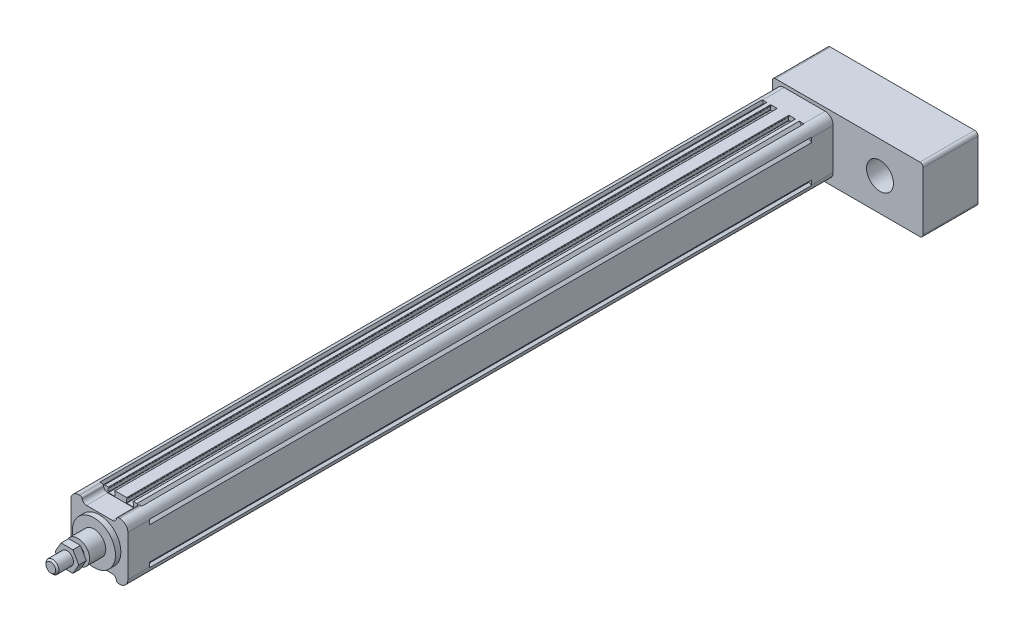
from build123d import *

# Parameters (mm, degrees)
SKETCH_1_R                  = 2.1
EXTRUDE_1_DEPTH             = 615
EXTRUDE_2_DEPTH             = 20
SKETCH_7_R                  = 20
EXTRUDE_3_DEPTH             = 5
SKETCH_9_R                  = 11
EXTRUDE_4_DEPTH             = 15
SKETCH_10_R                 = 6
EXTRUDE_5_DEPTH             = 25
EXTRUDE_START               = 20
EXTRUDE_6_DEPTH             = 20
EXTRUDE_7_DEPTH             = 51
SKETCH_13_R                 = 12.5
CUT_EXTRUDE_2_DEPTH         = 30
PATTERN_LINEAR_1_COUNT      = 2
PATTERN_LINEAR_1_PITCH      = 38
PATTERN_LINEAR_1_COUNT_DIR2 = 2
PATTERN_LINEAR_1_PITCH_DIR2 = 38
HOLE_WIZARD_M6_2_D          = 5
HOLE_WIZARD_M6_2_DEPTH      = 15
HOLE_WIZARD_M6_2_TIP        = 1.502151548
HOLE_WIZARD_M6_3_D          = 5
HOLE_WIZARD_M6_3_DEPTH      = 15
HOLE_WIZARD_M6_3_TIP        = 1.502151548
HOLE_WIZARD_M6_4_D          = 5
HOLE_WIZARD_M6_4_DEPTH      = 15
HOLE_WIZARD_M6_4_TIP        = 1.502151548
CHAMFER_1_SIZE              = 1.5
EXTRUDE_START_2             = 3
EXTRUDE_8_DEPTH             = 7


with BuildPart() as part:
    # 草图1 → 凸台-拉伸1 (new body)
    with BuildSketch(Plane.XY):
        with BuildLine():
            Line((-18.2, 24), (-19.443439638, 26.486879276))
            ThreePointArc((-19.443439638, 26.486879276), (-24.303300859, 24.303300859), (-26.486879276, 19.443439638))
            Line((-26.486879276, 19.443439638), (-24, 18.2))
            Line((-24, 18.2), (-24, 17.1))
            Line((-24, 17.1), (-26.5, 15))
            Line((-26.5, 15), (-26.5, -15))
            Line((-26.5, -15), (-24, -17.1))
            Line((-24, -17.1), (-24, -18.2))
            Line((-24, -18.2), (-26.486879276, -19.443439638))
            ThreePointArc((-26.486879276, -19.443439638), (-24.303300859, -24.303300859), (-19.443439638, -26.486879276))
            Line((-19.443439638, -26.486879276), (-18.2, -24))
            Line((-18.2, -24), (-17.1, -24))
            Line((-17.1, -24), (-15, -26.5))
            Line((-15, -26.5), (-11.65, -26.5))
            ThreePointArc((-11.65, -26.5), (-11.367157288, -26.382842712), (-11.25, -26.1))
            Line((-11.25, -26.1), (-11.25, -25.6))
            ThreePointArc((-11.25, -25.6), (-11.367157288, -25.317157288), (-11.65, -25.2))
            Line((-11.65, -25.2), (-11.75, -25.2))
            Line((-11.75, -25.2), (-11.75, -22.4))
            ThreePointArc((-11.75, -22.4), (-11.632842712, -22.117157288), (-11.35, -22))
            Line((-11.35, -22), (-5.65, -22))
            ThreePointArc((-5.65, -22), (-5.367157288, -22.117157288), (-5.25, -22.4))
            Line((-5.25, -22.4), (-5.25, -25.2))
            Line((-5.25, -25.2), (-5.35, -25.2))
            ThreePointArc((-5.35, -25.2), (-5.632842712, -25.317157288), (-5.75, -25.6))
            Line((-5.75, -25.6), (-5.75, -26.1))
            ThreePointArc((-5.75, -26.1), (-5.632842712, -26.382842712), (-5.35, -26.5))
            Line((-5.35, -26.5), (5.35, -26.5))
            ThreePointArc((5.35, -26.5), (5.632842712, -26.382842712), (5.75, -26.1))
            Line((5.75, -26.1), (5.75, -25.6))
            ThreePointArc((5.75, -25.6), (5.632842712, -25.317157288), (5.35, -25.2))
            Line((5.35, -25.2), (5.25, -25.2))
            Line((5.25, -25.2), (5.25, -22.4))
            ThreePointArc((5.25, -22.4), (5.367157288, -22.117157288), (5.65, -22))
            Line((5.65, -22), (11.35, -22))
            ThreePointArc((11.35, -22), (11.632842712, -22.117157288), (11.75, -22.4))
            Line((11.75, -22.4), (11.75, -25.2))
            Line((11.75, -25.2), (11.65, -25.2))
            ThreePointArc((11.65, -25.2), (11.367157288, -25.317157288), (11.25, -25.6))
            Line((11.25, -25.6), (11.25, -26.1))
            ThreePointArc((11.25, -26.1), (11.367157288, -26.382842712), (11.65, -26.5))
            Line((11.65, -26.5), (15, -26.5))
            Line((15, -26.5), (17.1, -24))
            Line((17.1, -24), (18.2, -24))
            Line((18.2, -24), (19.443439638, -26.486879276))
            ThreePointArc((19.443439638, -26.486879276), (24.303300859, -24.303300859), (26.486879276, -19.443439638))
            Line((26.486879276, -19.443439638), (24, -18.2))
            Line((24, -18.2), (24, -17.1))
            Line((24, -17.1), (26.5, -15))
            Line((26.5, -15), (26.5, 15))
            Line((26.5, 15), (24, 17.1))
            Line((24, 17.1), (24, 18.2))
            Line((24, 18.2), (26.486879276, 19.443439638))
            ThreePointArc((26.486879276, 19.443439638), (24.303300859, 24.303300859), (19.443439638, 26.486879276))
            Line((19.443439638, 26.486879276), (18.2, 24))
            Line((18.2, 24), (17.1, 24))
            Line((17.1, 24), (15, 26.5))
            Line((15, 26.5), (11.65, 26.5))
            ThreePointArc((11.65, 26.5), (11.367157288, 26.382842712), (11.25, 26.1))
            Line((11.25, 26.1), (11.25, 25.6))
            ThreePointArc((11.25, 25.6), (11.367157288, 25.317157288), (11.65, 25.2))
            Line((11.65, 25.2), (11.75, 25.2))
            Line((11.75, 25.2), (11.75, 22.4))
            ThreePointArc((11.75, 22.4), (11.632842712, 22.117157288), (11.35, 22))
            Line((11.35, 22), (5.65, 22))
            ThreePointArc((5.65, 22), (5.367157288, 22.117157288), (5.25, 22.4))
            Line((5.25, 22.4), (5.25, 25.2))
            Line((5.25, 25.2), (5.35, 25.2))
            ThreePointArc((5.35, 25.2), (5.632842712, 25.317157288), (5.75, 25.6))
            Line((5.75, 25.6), (5.75, 26.1))
            ThreePointArc((5.75, 26.1), (5.632842712, 26.382842712), (5.35, 26.5))
            Line((5.35, 26.5), (-5.35, 26.5))
            ThreePointArc((-5.35, 26.5), (-5.632842712, 26.382842712), (-5.75, 26.1))
            Line((-5.75, 26.1), (-5.75, 25.6))
            ThreePointArc((-5.75, 25.6), (-5.632842712, 25.317157288), (-5.35, 25.2))
            Line((-5.35, 25.2), (-5.25, 25.2))
            Line((-5.25, 25.2), (-5.25, 22.4))
            ThreePointArc((-5.25, 22.4), (-5.367157288, 22.117157288), (-5.65, 22))
            Line((-5.65, 22), (-11.35, 22))
            ThreePointArc((-11.35, 22), (-11.632842712, 22.117157288), (-11.75, 22.4))
            Line((-11.75, 22.4), (-11.75, 25.2))
            Line((-11.75, 25.2), (-11.65, 25.2))
            ThreePointArc((-11.65, 25.2), (-11.367157288, 25.317157288), (-11.25, 25.6))
            Line((-11.25, 25.6), (-11.25, 26.1))
            ThreePointArc((-11.25, 26.1), (-11.367157288, 26.382842712), (-11.65, 26.5))
            Line((-11.65, 26.5), (-15, 26.5))
            Line((-15, 26.5), (-17.1, 24))
            Line((-17.1, 24), (-18.2, 24))
        make_face()
        with Locations((19, 19)):
            Circle(SKETCH_1_R, mode=Mode.SUBTRACT)
        with Locations((19, -19)):
            Circle(SKETCH_1_R, mode=Mode.SUBTRACT)
        with Locations((-19, -19)):
            Circle(SKETCH_1_R, mode=Mode.SUBTRACT)
        with Locations((-19, 19)):
            Circle(SKETCH_1_R, mode=Mode.SUBTRACT)
        with BuildLine():
            Line((19.773719933, 3), (23.3, 3))
            Line((23.3, 3), (23.3, -3))
            Line((23.3, -3), (19.773719933, -3))
            ThreePointArc((19.773719933, -3), (0, -20), (-19.773719933, -3))
            Line((-19.773719933, -3), (-23.3, -3))
            Line((-23.3, -3), (-23.3, 3))
            Line((-23.3, 3), (-19.773719933, 3))
            ThreePointArc((-19.773719933, 3), (0, 20), (19.773719933, 3))
        make_face(mode=Mode.SUBTRACT)
    extrude(amount=EXTRUDE_1_DEPTH)

    # 草图6 → 凸台-拉伸2 (add)
    with BuildSketch(Plane.XY.offset(615)):
        with BuildLine():
            Line((-26.5, -19), (-26.5, 19))
            ThreePointArc((-26.5, 19), (-24.303300859, 24.303300859), (-19, 26.5))
            Line((-19, 26.5), (-17.916079783, 26.5))
            ThreePointArc((-17.916079783, 26.5), (-16.625085334, 26.027525232), (-15.944053189, 24.833333333))
            ThreePointArc((-15.944053189, 24.833333333), (-14.581988897, 22.444949537), (-12, 21.5))
            Line((-12, 21.5), (12, 21.5))
            ThreePointArc((12, 21.5), (14.581988897, 22.444949537), (15.944053189, 24.833333333))
            ThreePointArc((15.944053189, 24.833333333), (16.625085334, 26.027525232), (17.916079783, 26.5))
            Line((17.916079783, 26.5), (19, 26.5))
            ThreePointArc((19, 26.5), (24.303300859, 24.303300859), (26.5, 19))
            Line((26.5, 19), (26.5, -19))
            ThreePointArc((26.5, -19), (24.303300859, -24.303300859), (19, -26.5))
            Line((19, -26.5), (17.916079783, -26.5))
            ThreePointArc((17.916079783, -26.5), (16.625085334, -26.027525232), (15.944053189, -24.833333333))
            ThreePointArc((15.944053189, -24.833333333), (14.581988897, -22.444949537), (12, -21.5))
            Line((12, -21.5), (-12, -21.5))
            ThreePointArc((-12, -21.5), (-14.581988897, -22.444949537), (-15.944053189, -24.833333333))
            ThreePointArc((-15.944053189, -24.833333333), (-16.625085334, -26.027525232), (-17.916079783, -26.5))
            Line((-17.916079783, -26.5), (-19, -26.5))
            ThreePointArc((-19, -26.5), (-24.303300859, -24.303300859), (-26.5, -19))
        make_face()
    extrude(amount=EXTRUDE_2_DEPTH)

    # 草图7 → 凸台-拉伸3 (add)
    with BuildSketch(Plane.XY.offset(635)):
        Circle(SKETCH_7_R)
    extrude(amount=EXTRUDE_3_DEPTH)

    # 草图9 → 凸台-拉伸4 (add)
    with BuildSketch(Plane.XY.offset(640)):
        Circle(SKETCH_9_R)
    extrude(amount=EXTRUDE_4_DEPTH)

    # 草图10 → 凸台-拉伸5 (add)
    with BuildSketch(Plane.XY.offset(655)):
        Circle(SKETCH_10_R)
    extrude(amount=EXTRUDE_5_DEPTH)

    # 草图11 → 凸台-拉伸6 (add)
    with BuildSketch(Plane(origin=(0, 0, 0), x_dir=(-1, 0, 0), z_dir=(0, 0, -1)).offset(EXTRUDE_START)):
        with BuildLine():
            Line((-19, -26.5), (19, -26.5))
            ThreePointArc((19, -26.5), (24.303300859, -24.303300859), (26.5, -19))
            Line((26.5, -19), (26.5, 19))
            ThreePointArc((26.5, 19), (24.303300859, 24.303300859), (19, 26.5))
            Line((19, 26.5), (-19, 26.5))
            ThreePointArc((-19, 26.5), (-24.303300859, 24.303300859), (-26.5, 19))
            Line((-26.5, 19), (-26.5, -19))
            ThreePointArc((-26.5, -19), (-24.303300859, -24.303300859), (-19, -26.5))
        make_face()
    extrude(amount=-EXTRUDE_6_DEPTH)

    # 草图12 → 凸台-拉伸7 (add)
    with BuildSketch(Plane(origin=(0, 0, -20), x_dir=(-1, 0, 0), z_dir=(0, 0, -1))):
        with BuildLine():
            Line((-107, -30.404162038), (27, -30.404162038))
            ThreePointArc((27, -30.404162038), (29.121320344, -29.525482382), (30, -27.404162038))
            Line((30, -27.404162038), (30, 26.595837962))
            ThreePointArc((30, 26.595837962), (29.121320344, 28.717158305), (27, 29.595837962))
            Line((27, 29.595837962), (-107, 29.595837962))
            ThreePointArc((-107, 29.595837962), (-109.121320344, 28.717158305), (-110, 26.595837962))
            Line((-110, 26.595837962), (-110, -27.404162038))
            ThreePointArc((-110, -27.404162038), (-109.121320344, -29.525482382), (-107, -30.404162038))
        make_face()
    extrude(amount=EXTRUDE_7_DEPTH)

    # 草图13 → 切除-拉伸2 (cut)
    with BuildSketch(Plane.XY.offset(-20)):
        with Locations((70, 0)):
            Circle(SKETCH_13_R)
    extrude(amount=-CUT_EXTRUDE_2_DEPTH, mode=Mode.SUBTRACT)

    # 草图15 → M6 螺纹孔1 (revolve, cut)
    with BuildSketch(Plane(origin=(-19, -19, -71), x_dir=(0, 1, 0), z_dir=(1, 0, 0))):
        Polygon((0, 0), (0, 16.502151548), (2.5, 15), (2.5, 0), align=None)
    hole_wizard_m6_1 = revolve(axis=Axis((-19, -19, -77.35), (0, 0, 1)), mode=Mode.SUBTRACT)

    # 阵列(线性)1: Hole Wizard M6 _1 2 × 2
    with Locations(*[(j * PATTERN_LINEAR_1_PITCH_DIR2, i * PATTERN_LINEAR_1_PITCH, 0) for i in range(PATTERN_LINEAR_1_COUNT) for j in range(PATTERN_LINEAR_1_COUNT_DIR2) if (i, j) != (0, 0)]):
        add(hole_wizard_m6_1, mode=Mode.SUBTRACT)

    # M6 螺纹孔2
    with Locations(Plane(origin=(0, 0, -71), x_dir=(-1, 0, 0), z_dir=(0, 0, -1))):
        with Locations((-84, -19), (-84, 19)):
            Hole(HOLE_WIZARD_M6_2_D / 2, depth=HOLE_WIZARD_M6_2_DEPTH)
            with Locations((0, 0, -(HOLE_WIZARD_M6_2_DEPTH + HOLE_WIZARD_M6_2_TIP / 2))):  # 118° drill point
                Cone(0, HOLE_WIZARD_M6_2_D / 2, HOLE_WIZARD_M6_2_TIP, mode=Mode.SUBTRACT)

    # M6 螺纹孔3
    with Locations(Plane.ZY.offset(26.5)):
        with Locations((625, 11), (625, -11)):
            Hole(HOLE_WIZARD_M6_3_D / 2, depth=HOLE_WIZARD_M6_3_DEPTH)
            with Locations((0, 0, -(HOLE_WIZARD_M6_3_DEPTH + HOLE_WIZARD_M6_3_TIP / 2))):  # 118° drill point
                Cone(0, HOLE_WIZARD_M6_3_D / 2, HOLE_WIZARD_M6_3_TIP, mode=Mode.SUBTRACT)

    # M6 螺纹孔4
    with Locations(Plane.ZY.offset(26.5)):
        with Locations((-10, 11), (-10, -11)):
            Hole(HOLE_WIZARD_M6_4_D / 2, depth=HOLE_WIZARD_M6_4_DEPTH)
            with Locations((0, 0, -(HOLE_WIZARD_M6_4_DEPTH + HOLE_WIZARD_M6_4_TIP / 2))):  # 118° drill point
                Cone(0, HOLE_WIZARD_M6_4_D / 2, HOLE_WIZARD_M6_4_TIP, mode=Mode.SUBTRACT)

    # 倒角1
    chamfer_1_edges = [part.edges().sort_by_distance(p)[0] for p in [
        (-6, 0, 680),
    ]]
    chamfer(chamfer_1_edges, length=CHAMFER_1_SIZE)

    # 草图23 → 凸台-拉伸8 (add)
    with BuildSketch(Plane.XY.offset(655).offset(EXTRUDE_START_2)):
        Polygon((10.969655115, 0), (5.484827557, 9.5), (-5.484827557, 9.5), (-10.969655115, 0), (-5.484827557, -9.5), (5.484827557, -9.5), align=None)
    extrude(amount=EXTRUDE_8_DEPTH)


solid = part.part
